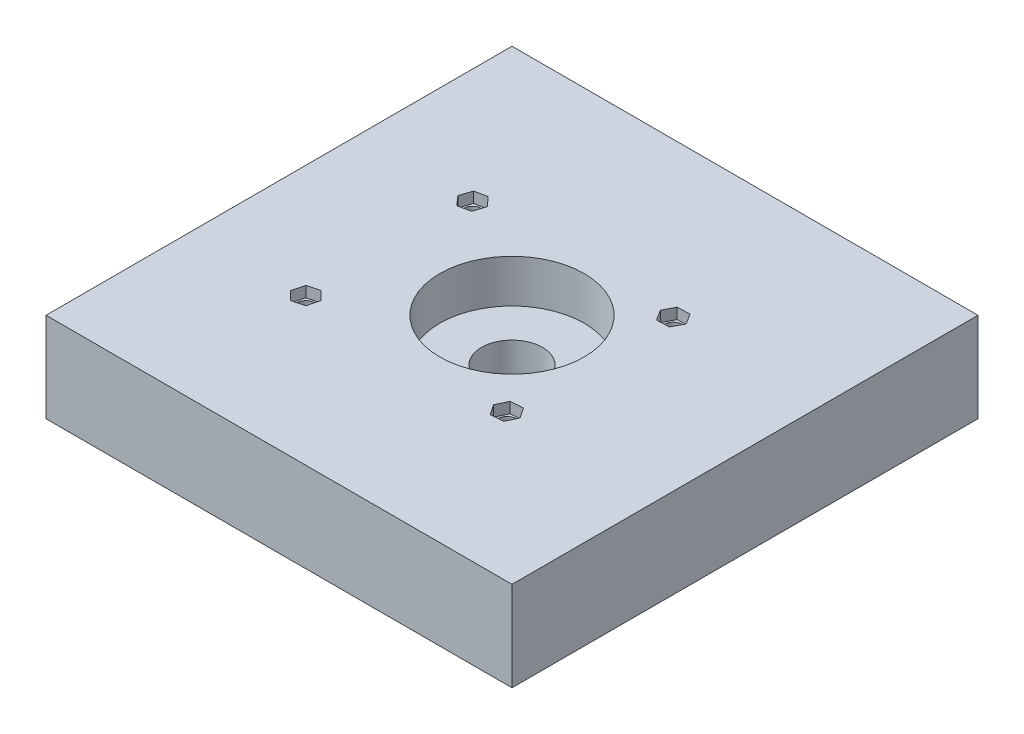
from build123d import *

# Parameters (mm, degrees)
SKETCH1_W           = 130
SKETCH1_H           = 130
BOSS_EXTRUDE1_DEPTH = 25
SKETCH2_R           = 20.15
CUT_EXTRUDE1_DEPTH  = 12
SKETCH3_R           = 8.5
CUT_EXTRUDE2_DEPTH  = 22
SKETCH5_R           = 2.5
CUT_EXTRUDE4_DEPTH  = 30
CUT_EXTRUDE7_DEPTH  = 3


with BuildPart() as part:
    # Sketch1 → Boss-Extrude1 (new body)
    with BuildSketch(Plane(origin=(0, 0, 0), x_dir=(1, 0, 0), z_dir=(0, 1, 0))):
        Rectangle(SKETCH1_W, SKETCH1_H)
    extrude(amount=BOSS_EXTRUDE1_DEPTH)

    # Sketch2 → Cut-Extrude1 (cut)
    with BuildSketch(Plane(origin=(0, 25, 0), x_dir=(1, 0, 0), z_dir=(0, 1, 0))):
        with Locations(Location((0, 0, 0), (0, 0, 270))):
            Circle(SKETCH2_R)
    extrude(amount=-CUT_EXTRUDE1_DEPTH, mode=Mode.SUBTRACT)

    # Sketch3 → Cut-Extrude2 (cut)
    with BuildSketch(Plane(origin=(0, 13, 0), x_dir=(1, 0, 0), z_dir=(0, 1, 0))):
        with Locations(Location((0, 0, 0), (0, 0, 270))):
            Circle(SKETCH3_R)
    extrude(amount=-CUT_EXTRUDE2_DEPTH, mode=Mode.SUBTRACT)

    # Sketch5 → Cut-Extrude4 (cut)
    with BuildSketch(Plane(origin=(0, 0, 0), x_dir=(-1, 0, 0), z_dir=(0, -1, 0))):
        with Locations(Location((-22.49, -23.94, 0), (0, 0, 90))):
            Circle(SKETCH5_R)
        with Locations(Location((33.509979516, -23.987898085, 0), (0, 0, 90))):
            Circle(SKETCH5_R)
        with Locations(Location((33.07, 22.06, 0), (0, 0, 90))):
            Circle(SKETCH5_R)
        with Locations(Location((-22.92999996, 22.057895604, 0), (0, 0, 90))):
            Circle(SKETCH5_R)
    extrude(amount=-CUT_EXTRUDE4_DEPTH, mode=Mode.SUBTRACT)

    # Sketch7 → Cut-Extrude7 (cut)
    with BuildSketch(Plane(origin=(0, 25, 0), x_dir=(1, 0, 0), z_dir=(0, 1, 0))):
        Polygon((23.984601443, -20.814913357), (20.530896299, -21.08309386), (19.036294857, -24.208180504), (20.995398557, -27.065086643), (24.449103701, -26.79690614), (25.943705143, -23.671819496), align=None)
        Polygon((-32.626257702, -20.638415176), (-35.968855897, -21.54783109), (-36.852577711, -24.897313998), (-34.39370133, -27.337380993), (-31.051103134, -26.42796508), (-30.16738132, -23.078482171), align=None)
        Polygon((-34.147910167, 18.767871559), (-30.757888221, 19.480438192), (-29.679978054, 22.772566633), (-31.992089833, 25.352128441), (-35.382111779, 24.639561808), (-36.460021946, 21.347433367), align=None)
        Polygon((24.779410064, 19.128786138), (26.391388221, 22.194977003), (24.541978117, 25.12408647), (21.080589856, 24.987005071), (19.4686117, 21.920814206), (21.318021804, 18.991704739), align=None)
    extrude(amount=-CUT_EXTRUDE7_DEPTH, mode=Mode.SUBTRACT)


solid = part.part
